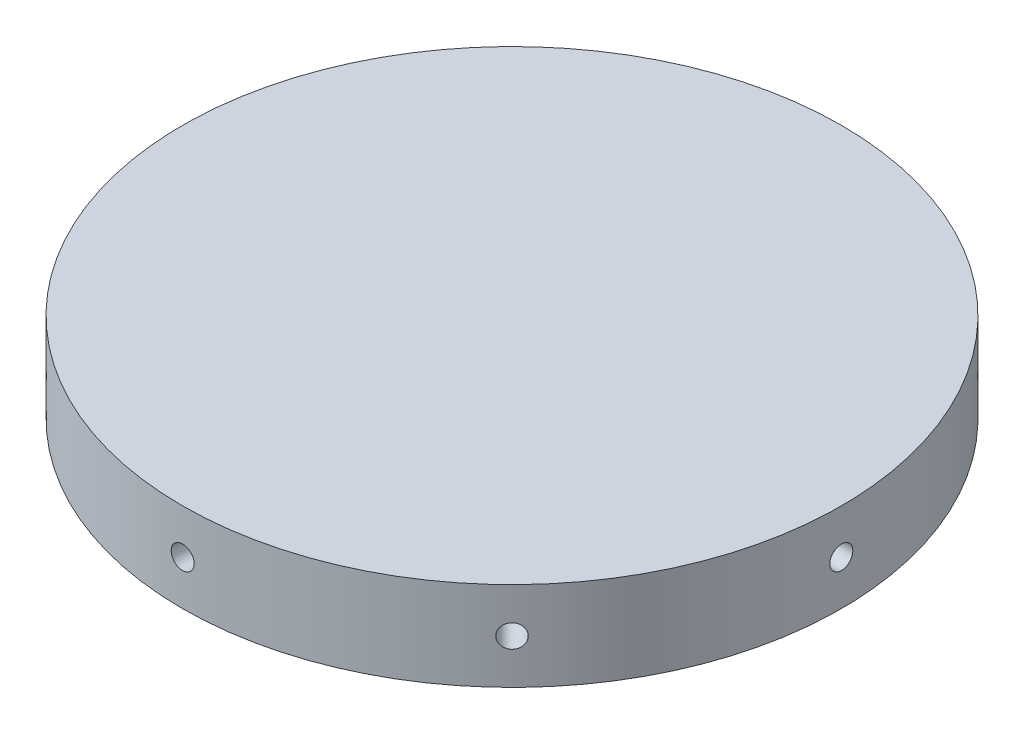
from build123d import *

# Parameters (mm, degrees)
SKETCH1_R                = 46.99
BULKHEAD_EXTRUSION_DEPTH = 12.7
SKETCH2_R                = 1.6383
SCREW_HOLE_DEPTH         = 12.7
CIRPATTERN1_COUNT        = 8


with BuildPart() as part:
    # Sketch1 → Bulkhead Extrusion (new body)
    with BuildSketch(Plane(origin=(0, 0, 0), x_dir=(1, 0, 0), z_dir=(0, 1, 0))):
        with Locations(Location((0, 0, 0), (0, 0, 270))):
            Circle(SKETCH1_R)
    extrude(amount=BULKHEAD_EXTRUSION_DEPTH)

    # Sketch2 → Screw Hole (cut)
    with BuildSketch(Plane.XY.offset(46.99)):
        with Locations((0, 6.35)):
            Circle(SKETCH2_R)
    screw_hole = extrude(amount=-SCREW_HOLE_DEPTH, mode=Mode.SUBTRACT)

    # CirPattern1: Screw Hole ×8 about axis
    cirpattern1_axis = Axis((0, 0, 0), (0, 1, 0))
    for i in range(1, CIRPATTERN1_COUNT):
        add(screw_hole.rotate(cirpattern1_axis, i * 360 / CIRPATTERN1_COUNT), mode=Mode.SUBTRACT)


solid = part.part
